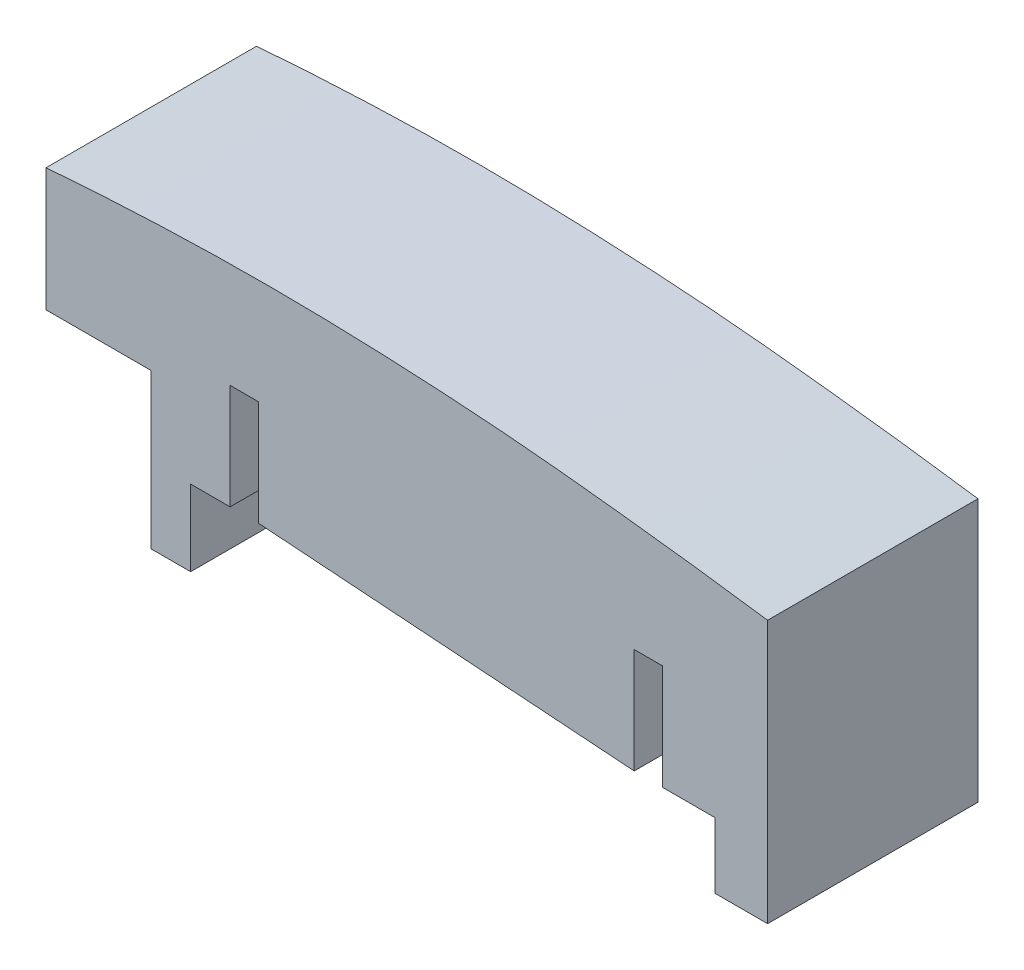
from build123d import *

# Parameters (mm, degrees)
BOSS_EXTRUDE1_DEPTH = 25.4


with BuildPart() as part:
    # Sketch1 → Boss-Extrude1 (new body)
    with BuildSketch(Plane.XY):
        with BuildLine():
            Line((2220.692415066, 2956.519458786), (2207.992415066, 2956.519458786))
            Line((2207.992415066, 2956.519458786), (2207.992415066, 2971.373508056))
            add(Edge.make_bspline(
                [(2295.101715066, 2967.625549053), (2290.064424466, 2968.346081243), (2285.012310956, 2969.008222259), (2275.661688407, 2970.095859332), (2271.46891104, 2970.561992631), (2263.712580892, 2971.284066653), (2260.22175859, 2971.544191767), (2253.376045681, 2971.962739192), (2249.944376881, 2972.130760127), (2239.630606872, 2972.494910089), (2232.684433427, 2972.539406456), (2220.026077535, 2972.178011529), (2214.353563633, 2971.875813493), (2208.634622958, 2971.424716902), (2208.420612585, 2971.407836267), (2208.206537198, 2971.390747122), (2207.992415066, 2971.373508056)],
                knots=[8.102631096, 8.102631096, 8.102631096, 8.102631096, 8.693015228, 8.693015228, 9.188395438, 9.188395438, 9.581928848, 9.581928848, 9.975462257, 9.975462257, 10.762529077, 10.762529077, 11.414127093, 11.414127093, 11.414127093, 11.438510758, 11.438510758, 11.438510758, 11.438510758], degree=3))
            Line((2295.101715066, 2967.625549053), (2295.101715066, 2935.897056736))
            Line((2295.101715066, 2935.897056736), (2288.751715066, 2935.897056736))
            Line((2288.751715066, 2935.897056736), (2288.751715066, 2943.811183941))
            Line((2288.751715066, 2943.811183941), (2282.401715066, 2943.811183941))
            Line((2282.401715066, 2943.811183941), (2282.401715066, 2956.511183941))
            Line((2282.401715066, 2956.511183941), (2278.998115066, 2956.511183941))
            Line((2278.998115066, 2956.511183941), (2278.998115066, 2943.811183941))
            Line((2278.998115066, 2943.811183941), (2233.621015066, 2947.035979773))
            Line((2233.621015066, 2947.035979773), (2233.621015066, 2959.735979773))
            Line((2233.621015066, 2959.735979773), (2230.217415066, 2959.735979773))
            Line((2230.217415066, 2959.735979773), (2230.217415066, 2947.035979773))
            Line((2230.217415066, 2947.035979773), (2225.454915066, 2947.035979773))
            Line((2225.454915066, 2947.035979773), (2225.454915066, 2937.871351382))
            Line((2225.454915066, 2937.871351382), (2220.692415066, 2937.871351382))
            Line((2220.692415066, 2937.871351382), (2220.692415066, 2956.519458786))
        make_face()
    extrude(amount=BOSS_EXTRUDE1_DEPTH)


solid = part.part
